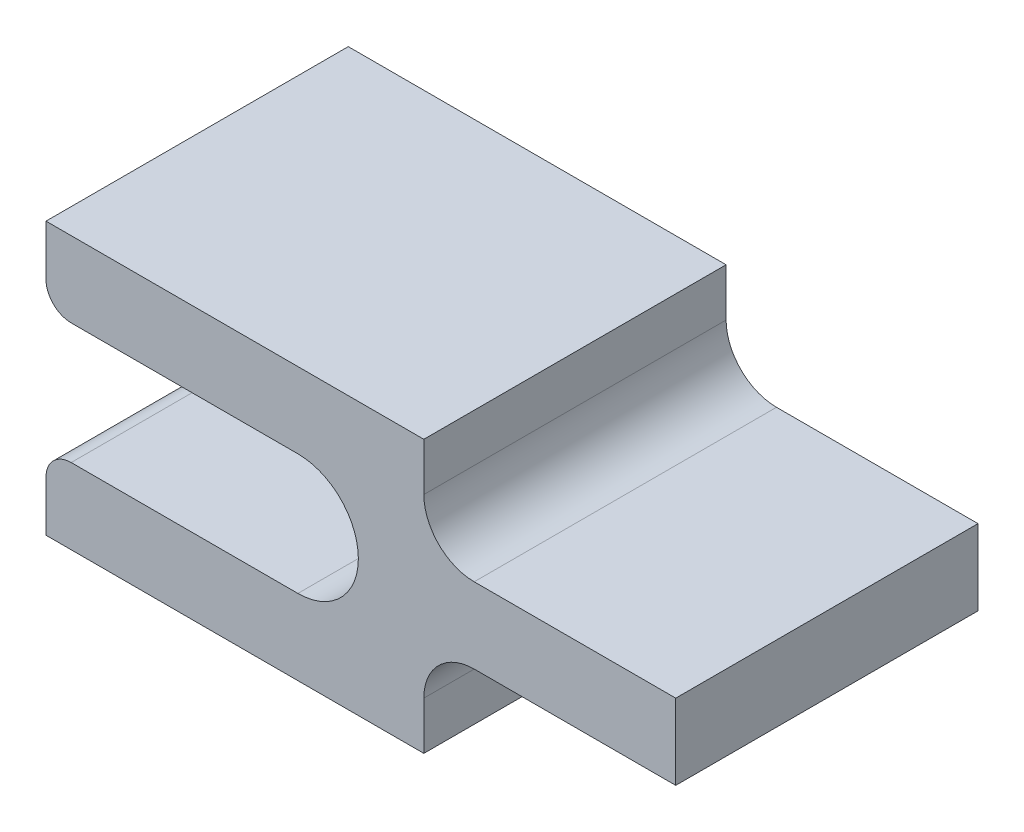
from build123d import *

# Parameters (mm, degrees)
BOSS_EXTRUDE1_DEPTH      = 10
BOSS_EXTRUDE1_DEPTH_BACK = 2
BOSS_EXTRUDE2_DEPTH      = 2
FILLET6_R                = 1
FILLET7_R                = 1
BOSS_EXTRUDE3_DEPTH      = 10
BOSS_EXTRUDE3_DEPTH_BACK = 2
SKETCH1_5_W              = 10
SKETCH1_5_H              = 3
FILLET8_R                = 2


with BuildPart() as part:
    # Sketch1 → Boss-Extrude1 (new, two sides: drawn at the far end of the back side and taken through both)
    with BuildSketch(Plane.XY.offset(-BOSS_EXTRUDE1_DEPTH_BACK)):
        with BuildLine():
            Line((-10, 2.4), (0, 2.4))
            ThreePointArc((0, 2.4), (2.4, 0), (0, -2.4))
            Line((0, -2.4), (-10, -2.4))
            Line((-10, -2.4), (-10, -5.4))
            Line((-10, -5.4), (5, -5.4))
            Line((5, -5.4), (5, -1.5))
            Line((5, -1.5), (5, 1.5))
            Line((5, 1.5), (5, 5.4))
            Line((5, 5.4), (-10, 5.4))
            Line((-10, 5.4), (-10, 2.4))
        make_face()
    extrude(amount=BOSS_EXTRUDE1_DEPTH + BOSS_EXTRUDE1_DEPTH_BACK)

    # Sketch1<4> → Boss-Extrude2 (add)
    with BuildSketch(Plane.XY):
        with BuildLine():
            Line((-10, -1.6), (-10, -5.4))
            Line((-10, -5.4), (5, -5.4))
            Line((5, -5.4), (5, 5.4))
            Line((5, 5.4), (-10, 5.4))
            Line((-10, 5.4), (-10, 1.6))
            Line((-10, 1.6), (0, 1.6))
            ThreePointArc((0, 1.6), (1.6, 0), (0, -1.6))
            Line((0, -1.6), (-10, -1.6))
        make_face()
    extrude(amount=-BOSS_EXTRUDE2_DEPTH)

    # Fillet6
    fillet6_edges = [part.edges().sort_by_distance(p)[0] for p in [
        (-10, 2.4, 5),
        (-10, -2.4, 5),
    ]]
    fillet(fillet6_edges, radius=FILLET6_R)

    # Fillet7
    fillet7_edges = [part.edges().sort_by_distance(p)[0] for p in [
        (-10, 1.6, -1),
        (-10, -1.6, -1),
    ]]
    fillet(fillet7_edges, radius=FILLET7_R)

    # Sketch1<5> → Boss-Extrude3 (add, two sides: drawn at the far end of the back side and taken through both)
    with BuildSketch(Plane.XY.offset(-BOSS_EXTRUDE3_DEPTH_BACK)):
        with Locations((10, 0)):
            Rectangle(SKETCH1_5_W, SKETCH1_5_H)
    extrude(amount=BOSS_EXTRUDE3_DEPTH + BOSS_EXTRUDE3_DEPTH_BACK)

    # Fillet8
    fillet8_edges = [part.edges().sort_by_distance(p)[0] for p in [
        (5, -1.5, 4),
        (5, 1.5, 4),
    ]]
    fillet(fillet8_edges, radius=FILLET8_R)


solid = part.part
